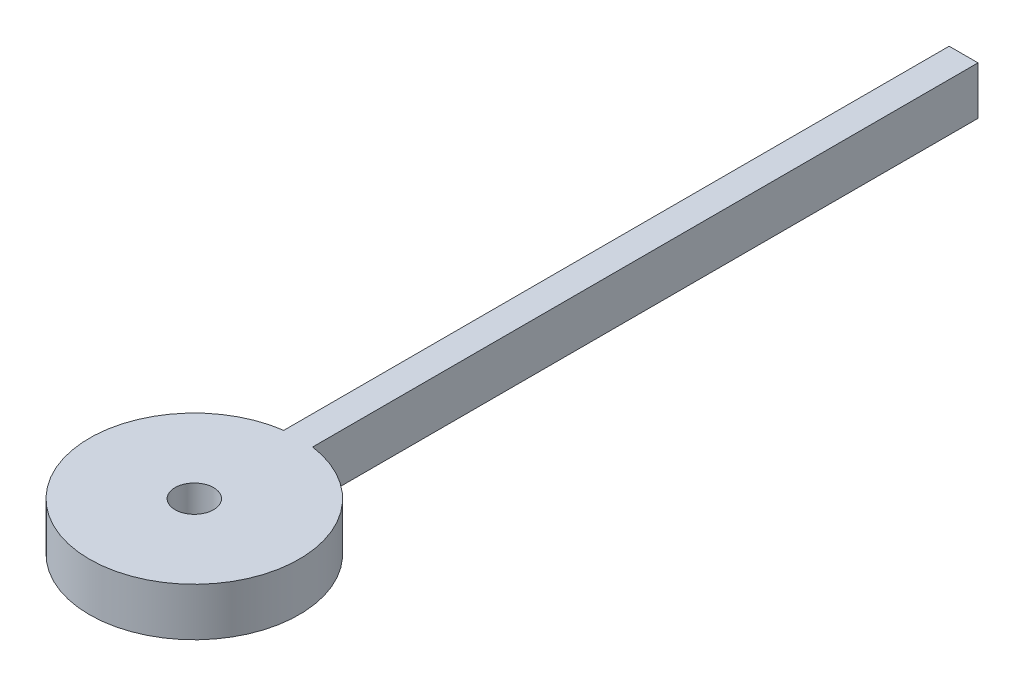
from build123d import *

# Parameters (mm, degrees)
SKETCH1_R           = 4
BOSS_EXTRUDE1_DEPTH = 10


with BuildPart() as part:
    # Sketch1 → Boss-Extrude1 (new body)
    with BuildSketch(Plane(origin=(0, 0, 0), x_dir=(1, 0, 0), z_dir=(0, 1, 0))):
        with BuildLine():
            Line((-3, 160), (3, 160))
            Line((3, 160), (3, 21.610069048))
            ThreePointArc((3, 21.610069048), (0, -21.817311573), (-3, 21.610069048))
            Line((-3, 21.610069048), (-3, 160))
        make_face()
        with Locations(Location((0, 0, 0), (0, 0, 270))):
            Circle(SKETCH1_R, mode=Mode.SUBTRACT)
    extrude(amount=BOSS_EXTRUDE1_DEPTH)


solid = part.part
